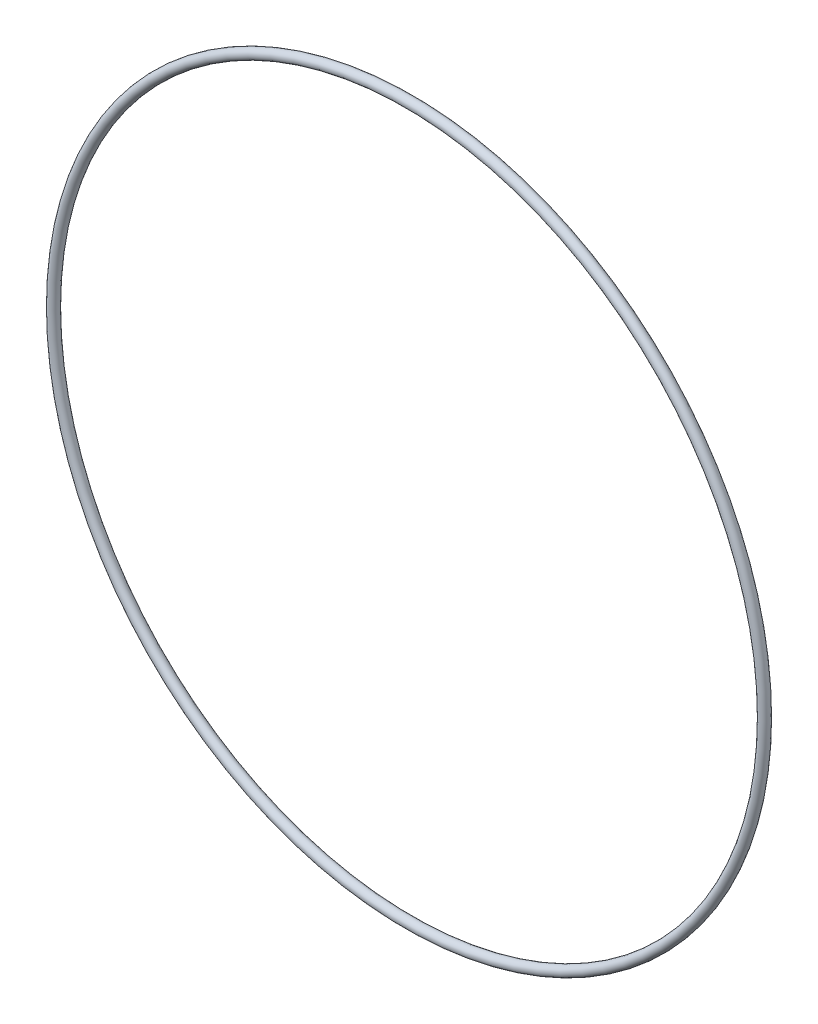
from build123d import *

# Parameters (mm, degrees)
SKETCH7_R = 1.5


with BuildPart() as part:
    # Sketch7 → Revolve1 (revolve)
    with BuildSketch(Plane(origin=(0, 0, 0), x_dir=(0, 0, -1), z_dir=(1, 0, 0)), mode=Mode.PRIVATE) as revolve1_sk:
        with Locations((0, 106.25)):
            Circle(SKETCH7_R)
    revolve(revolve1_sk.sketch.rotate(Axis((0, 0, 0), (0, 0, -1)), 90), axis=Axis((0, 0, 0), (0, 0, -1)))


solid = part.part
